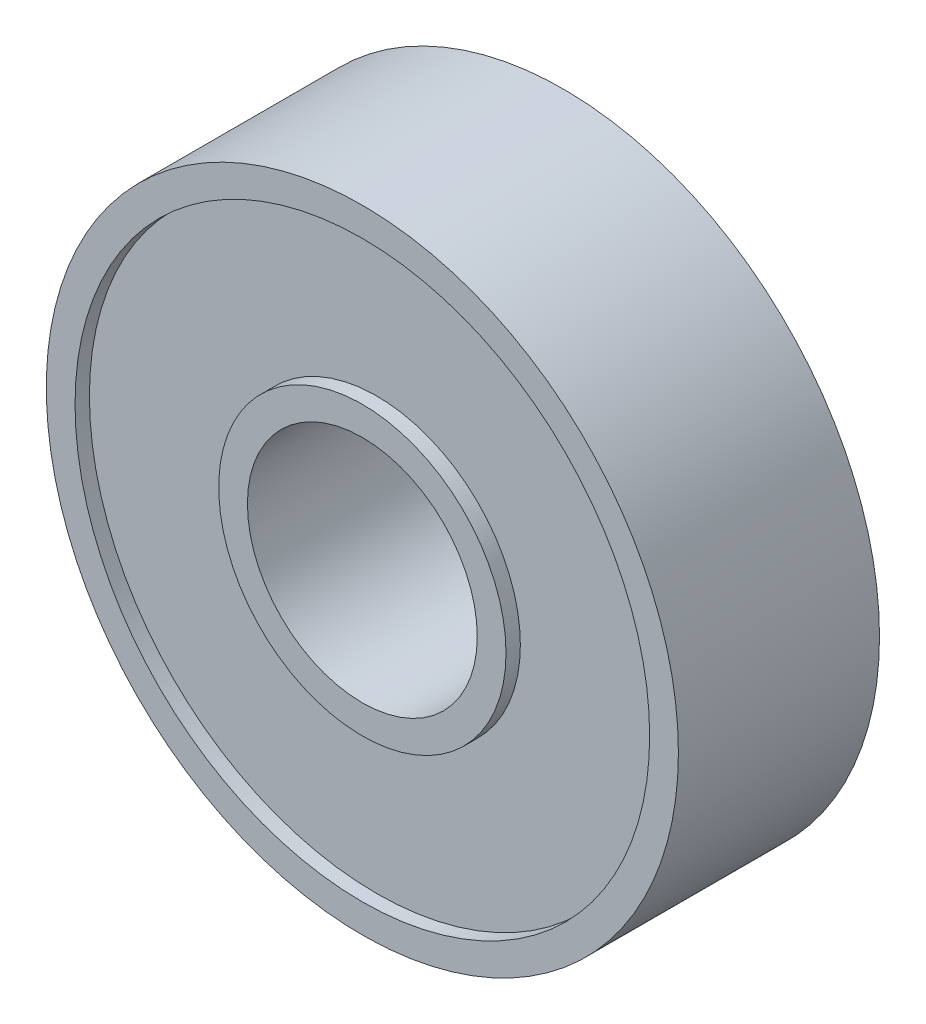
from build123d import *

# Parameters (mm, degrees)
CROQUIS1_R              = 11
SALIENTE_EXTRUIR1_DEPTH = 7
CROQUIS2_R              = 4
CORTAR_EXTRUIR1_DEPTH   = 7
CROQUIS3_R              = 10
CROQUIS3_R_2            = 5
CORTAR_EXTRUIR2_DEPTH   = 0.5
CORTAR_EXTRUIR3_START   = -0.5
CROQUIS4_R              = 10
CROQUIS4_R_2            = 5
CORTAR_EXTRUIR3_DEPTH   = 0.5


with BuildPart() as part:
    # Croquis1 → Saliente-Extruir1 (new body)
    with BuildSketch(Plane.XY):
        Circle(CROQUIS1_R)
    extrude(amount=SALIENTE_EXTRUIR1_DEPTH)

    # Croquis2 → Cortar-Extruir1 (cut)
    with BuildSketch(Plane.XY.offset(7)):
        Circle(CROQUIS2_R)
    extrude(amount=-CORTAR_EXTRUIR1_DEPTH, mode=Mode.SUBTRACT)

    # Croquis3 → Cortar-Extruir2 (cut)
    with BuildSketch(Plane.XY.offset(7)):
        Circle(CROQUIS3_R)
        Circle(CROQUIS3_R_2, mode=Mode.SUBTRACT)
    extrude(amount=-CORTAR_EXTRUIR2_DEPTH, mode=Mode.SUBTRACT)

    # Croquis4 → Cortar-Extruir3 (cut)
    with BuildSketch(Plane(origin=(0, 0, 0), x_dir=(-1, 0, 0), z_dir=(0, 0, -1)).offset(CORTAR_EXTRUIR3_START)):
        with Locations(Location((0, 0, 0), (0, 0, 180))):
            Circle(CROQUIS4_R)
        with Locations(Location((0, 0, 0), (0, 0, 180))):
            Circle(CROQUIS4_R_2, mode=Mode.SUBTRACT)
    extrude(amount=CORTAR_EXTRUIR3_DEPTH, mode=Mode.SUBTRACT)


solid = part.part
